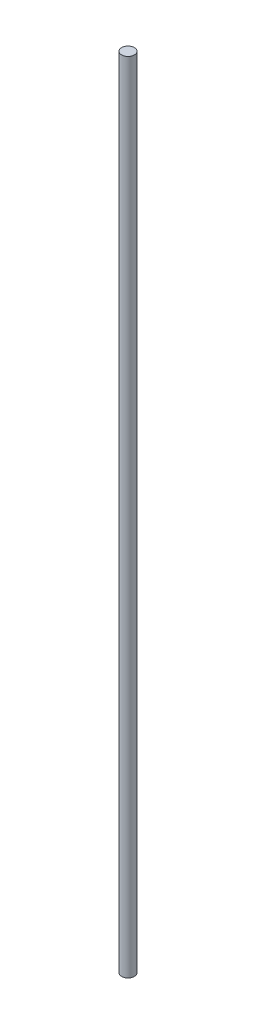
from build123d import *

# Parameters (mm, degrees)
SKETCH_1_R      = 2
EXTRUDE_1_DEPTH = 250


with BuildPart() as part:
    # 草图1 → 凸台-拉伸1 (new body)
    with BuildSketch(Plane(origin=(0, 0, 0), x_dir=(1, 0, 0), z_dir=(0, 1, 0))):
        with Locations(Location((0, 0, 0), (0, 0, 270))):
            Circle(SKETCH_1_R)
    extrude(amount=EXTRUDE_1_DEPTH)


solid = part.part
